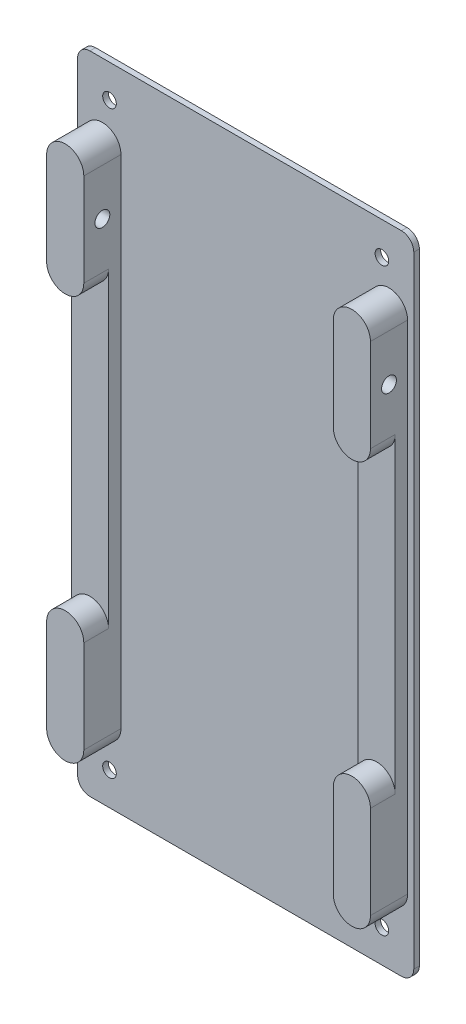
from build123d import *

# Parameters (mm, degrees)
SKICA1_W                      = 54.3
SKICA1_H                      = 104.3
P_IDAT_VYSUNUT_M1_DEPTH       = 0.9
ZAOBLIT1_R                    = 2
SKICA2_R                      = 1.1
ODEBRAT_VYSUNUT_M1_DEPTH      = 0.9
P_IDAT_VYSUNUT_M2_DEPTH       = 6
ODEBRAT_VYSUNUT_M2_DEPTH      = 118.332817234
ODEBRAT_VYSUNUT_M2_DEPTH_BACK = 118.332817234
SKICA4_R                      = 1.2
SKICA5_W                      = 6
SKICA5_H                      = 50.3
P_IDAT_VYSUNUT_M3_DEPTH       = 2


with BuildPart() as part:
    # Skica1 → Přidat vysunutím1 (new body)
    with BuildSketch(Plane.XY):
        with Locations((27.15, 52.15)):
            Rectangle(SKICA1_W, SKICA1_H)
    extrude(amount=P_IDAT_VYSUNUT_M1_DEPTH)

    # Zaoblit1
    zaoblit1_edges = [part.edges().sort_by_distance(p)[0] for p in [
        (0, 104.3, 0.45),
        (54.3, 104.3, 0.45),
        (54.3, 0, 0.45),
        (0, 0, 0.45),
    ]]
    fillet(zaoblit1_edges, radius=ZAOBLIT1_R)

    # Skica2 → Odebrat vysunutím1 (cut)
    with BuildSketch(Plane.XY.offset(0.9)):
        with Locations((5.15, 99)):
            Circle(SKICA2_R)
        with Locations((49.15, 99)):
            Circle(SKICA2_R)
        with Locations((5.15, 5.3)):
            Circle(SKICA2_R)
        with Locations((49.15, 5.3)):
            Circle(SKICA2_R)
    extrude(amount=-ODEBRAT_VYSUNUT_M1_DEPTH, mode=Mode.SUBTRACT)

    # Skica3 → Přidat vysunutím2 (add)
    with BuildSketch(Plane.XY.offset(0.9)):
        with BuildLine():
            Line((7, 92.3), (7, 77.3))
            ThreePointArc((7, 77.3), (4, 74.3), (1, 77.3))
            Line((1, 77.3), (1, 92.3))
            ThreePointArc((1, 92.3), (4, 95.3), (7, 92.3))
        make_face()
        with BuildLine():
            Line((53.3, 92.3), (53.3, 77.3))
            ThreePointArc((53.3, 77.3), (50.3, 74.3), (47.3, 77.3))
            Line((47.3, 77.3), (47.3, 92.3))
            ThreePointArc((47.3, 92.3), (50.3, 95.3), (53.3, 92.3))
        make_face()
        with BuildLine():
            Line((7, 27), (7, 12))
            ThreePointArc((7, 12), (4, 9), (1, 12))
            Line((1, 12), (1, 27))
            ThreePointArc((1, 27), (4, 30), (7, 27))
        make_face()
        with BuildLine():
            Line((53.3, 27), (53.3, 12))
            ThreePointArc((53.3, 12), (50.3, 9), (47.3, 12))
            Line((47.3, 12), (47.3, 27))
            ThreePointArc((47.3, 27), (50.3, 30), (53.3, 27))
        make_face()
    extrude(amount=P_IDAT_VYSUNUT_M2_DEPTH)

    # Skica4 → Odebrat vysunutím2 (cut, two sides: drawn at the far end of the back side and taken through both)
    with BuildSketch(Plane(origin=(53.3, 0, 0), x_dir=(0, 0, -1), z_dir=(1, 0, 0)).offset(-ODEBRAT_VYSUNUT_M2_DEPTH_BACK)):
        with Locations((-3.9, 84.8)):
            Circle(SKICA4_R)
    extrude(amount=ODEBRAT_VYSUNUT_M2_DEPTH + ODEBRAT_VYSUNUT_M2_DEPTH_BACK, mode=Mode.SUBTRACT)

    # Skica5 → Přidat vysunutím3 (add)
    with BuildSketch(Plane.XY.offset(0.9)):
        with Locations((4, 52.15)):
            Rectangle(SKICA5_W, SKICA5_H)
        with Locations((50.3, 52.15)):
            Rectangle(SKICA5_W, SKICA5_H)
    extrude(amount=P_IDAT_VYSUNUT_M3_DEPTH)


solid = part.part
